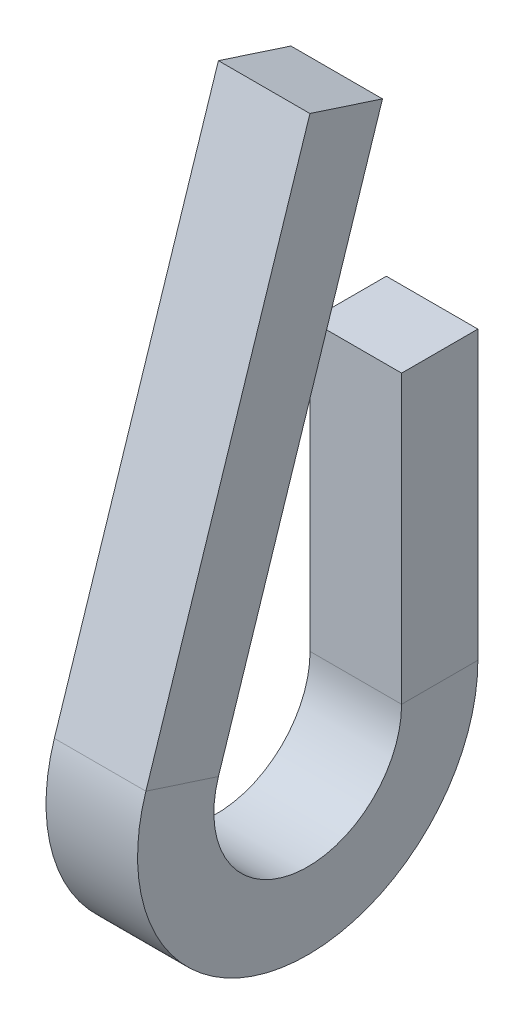
from build123d import *

# Parameters (mm, degrees)
ESQUISSE1_W = 12
ESQUISSE1_H = 10


with BuildPart() as part:
    # Balayage1: sweep along a path in Esquisse2
    with BuildLine(Plane(origin=(0, 0, 0), x_dir=(0, 0, -1), z_dir=(1, 0, 0))) as balayage1_path:
        Line((0, 0), (0, -37.597886471))
        ThreePointArc((0, -37.597886471), (-20.015041061, -54.692346459), (-33.767997639, -32.249561064))
        Line((-33.767997639, -32.249561064), (-12.263031239, 33.935919994))
    # Esquisse1 → Balayage1 (sweep)
    with BuildSketch(Plane(origin=(0, 0, 0), x_dir=(1, 0, 0), z_dir=(0, 1, 0))):
        Rectangle(ESQUISSE1_W, ESQUISSE1_H)
    sweep(path=balayage1_path.line)


solid = part.part
